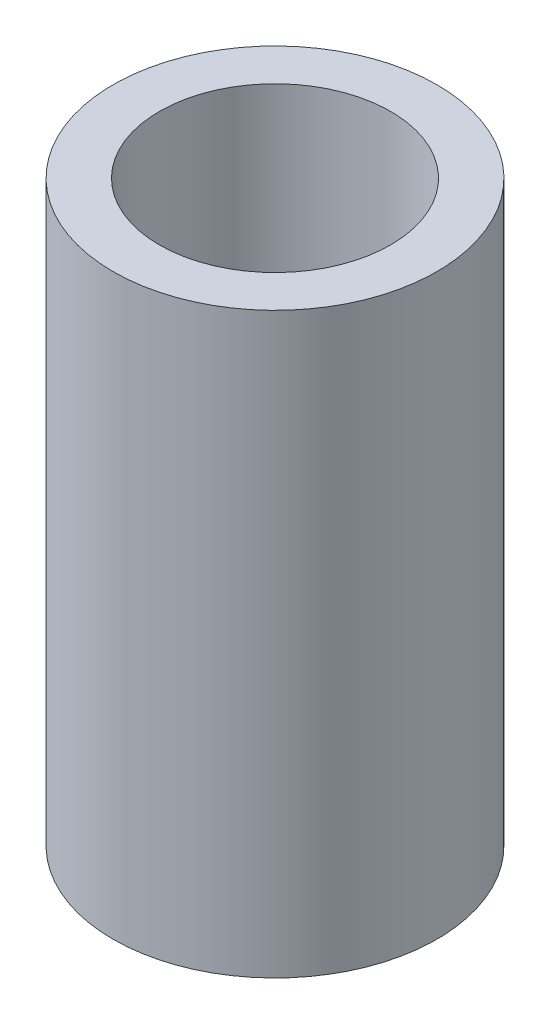
from build123d import *

# Parameters (mm, degrees)
SKETCH_1_R      = 7
SKETCH_1_R_2    = 3
EXTRUDE_1_DEPTH = 12.5
SKETCH_2_R      = 7
SKETCH_2_R_2    = 5
EXTRUDE_2_DEPTH = 12.5


with BuildPart() as part:
    # 草图1 → 凸台-拉伸1 (new body)
    with BuildSketch(Plane(origin=(0, 0, 0), x_dir=(1, 0, 0), z_dir=(0, 1, 0))):
        with Locations(Location((0, 0, 0), (0, 0, 270))):
            Circle(SKETCH_1_R)
        with Locations(Location((0, 0, 0), (0, 0, 270))):
            Circle(SKETCH_1_R_2, mode=Mode.SUBTRACT)
    extrude(amount=EXTRUDE_1_DEPTH)

    # 草图2 → 凸台-拉伸2 (add)
    with BuildSketch(Plane(origin=(0, 12.5, 0), x_dir=(1, 0, 0), z_dir=(0, 1, 0))):
        with Locations(Location((0, 0, 0), (0, 0, 270))):
            Circle(SKETCH_2_R)
        with Locations(Location((0, 0, 0), (0, 0, 270))):
            Circle(SKETCH_2_R_2, mode=Mode.SUBTRACT)
    extrude(amount=EXTRUDE_2_DEPTH)


solid = part.part
